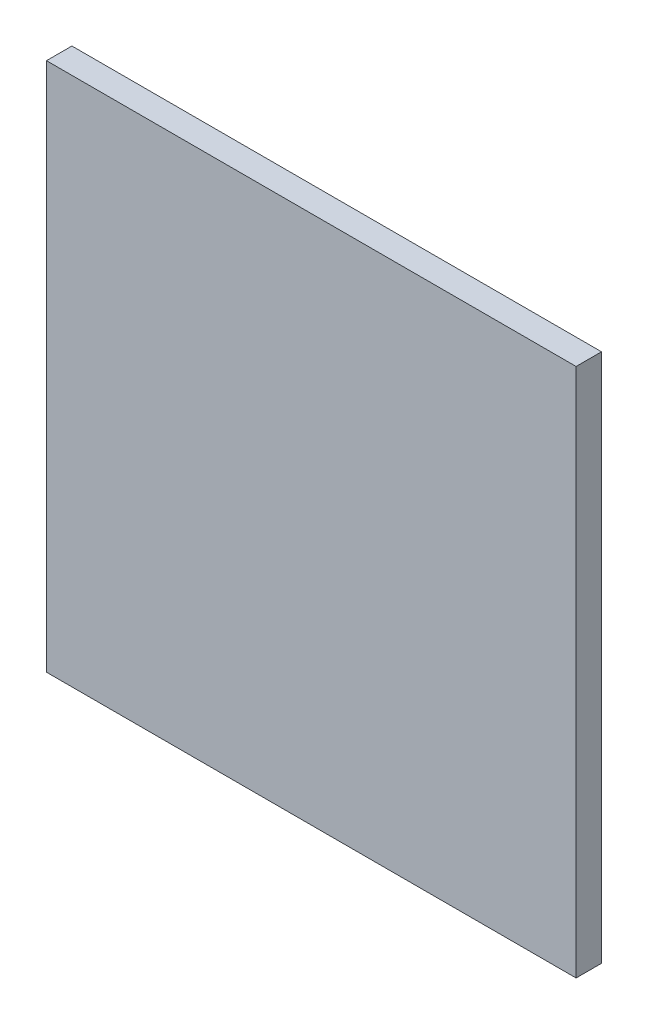
from build123d import *

# Parameters (mm, degrees)
SKETCH1_W   = 125
SKETCH1_H   = 125
PLATE_DEPTH = 6


with BuildPart() as part:
    # Sketch1 → Plate (new body)
    with BuildSketch(Plane.XY):
        with Locations((62.5, 62.5)):
            Rectangle(SKETCH1_W, SKETCH1_H)
    extrude(amount=PLATE_DEPTH)


solid = part.part
